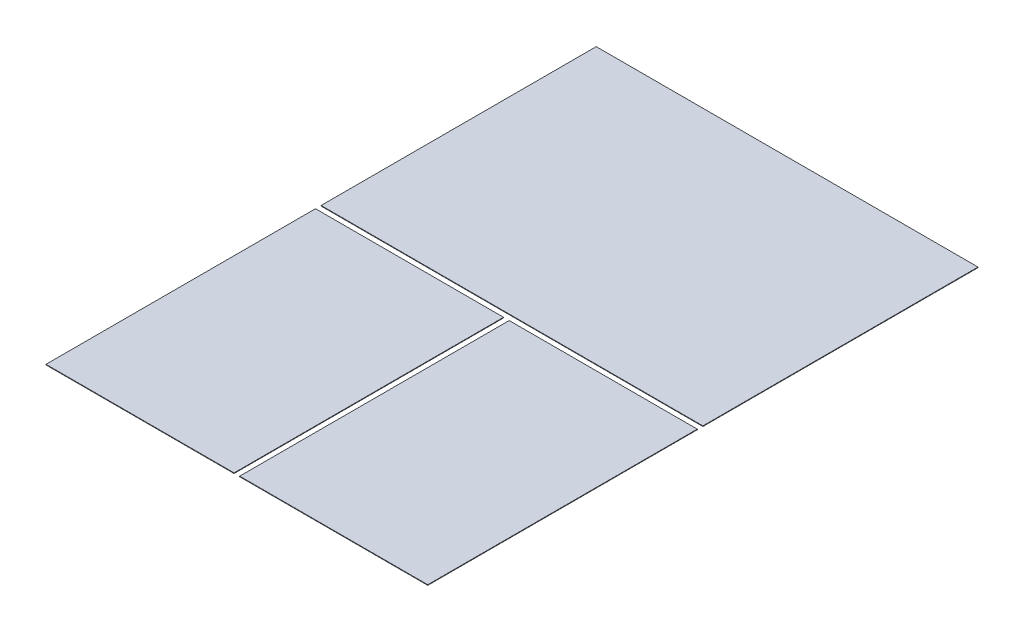
from build123d import *

# Parameters (mm, degrees)
SKETCH1_W             = 3400
SKETCH1_H             = 2450
BOSS_EXTRUDE1_DEPTH   = 5
SKETCH1_W_2           = 1675
SKETCH1_H_2           = 2400
BOSS_EXTRUDE1_2_DEPTH = 5
BOSS_EXTRUDE1_3_DEPTH = 5


with BuildPart() as part:
    # Sketch1 → Boss-Extrude1 (new body)
    with BuildSketch(Plane(origin=(0, 0, 0), x_dir=(1, 0, 0), z_dir=(0, 1, 0))):
        with Locations((147.303454747, 1250.220969453)):
            Rectangle(SKETCH1_W, SKETCH1_H)
    extrude(amount=BOSS_EXTRUDE1_DEPTH)


with BuildPart() as body_2:
    # Sketch1 → Boss-Extrude1 2 (new body)
    with BuildSketch(Plane(origin=(0, 0, 0), x_dir=(1, 0, 0), z_dir=(0, 1, 0))):
        with Locations((1009.803454747, -1224.779030547)):
            Rectangle(SKETCH1_W_2, SKETCH1_H_2)
    extrude(amount=BOSS_EXTRUDE1_2_DEPTH)


with BuildPart() as body_3:
    # Sketch1 → Boss-Extrude1 3 (new body)
    with BuildSketch(Plane(origin=(0, 0, 0), x_dir=(1, 0, 0), z_dir=(0, 1, 0))):
        with Locations((-715.196545253, -1224.779030547)):
            Rectangle(SKETCH1_W_2, SKETCH1_H_2)
    extrude(amount=BOSS_EXTRUDE1_3_DEPTH)


solid = Compound([part.part, body_2.part, body_3.part])
